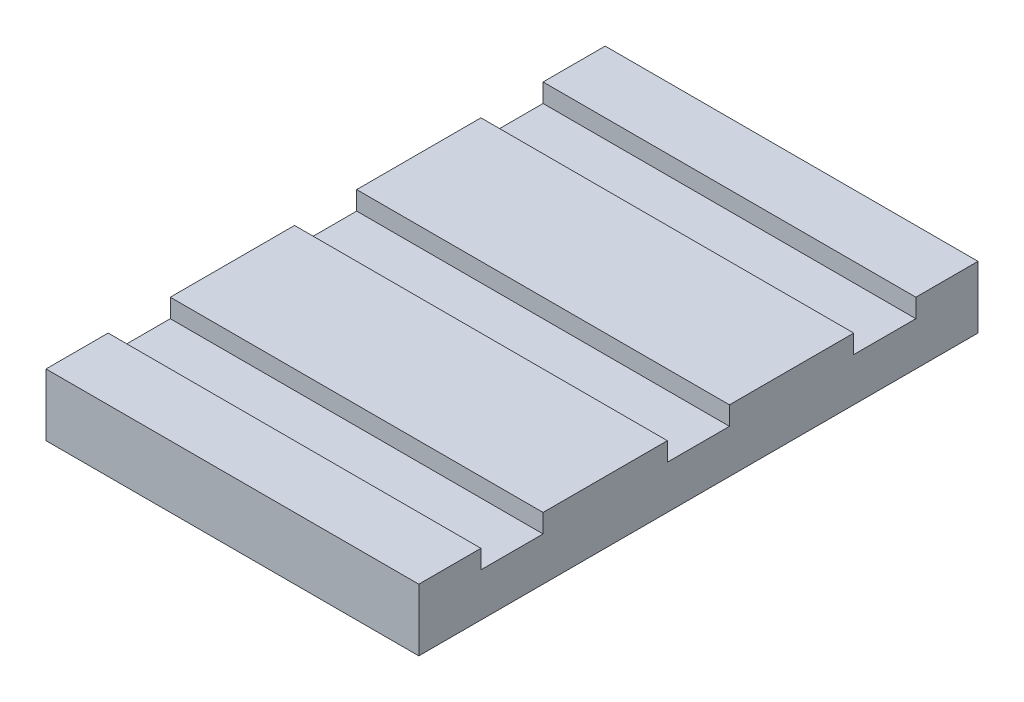
from build123d import *

# Parameters (mm, degrees)
SKETCH2_W           = 76.2
SKETCH2_H           = 114.3
BOSS_EXTRUDE1_DEPTH = 12.7
SKETCH4_W           = 12.7
SKETCH4_H           = 3.81
CUT_EXTRUDE1_DEPTH  = 76.2
SKETCH5_W           = 12.7
SKETCH5_H           = 3.81
CUT_EXTRUDE2_DEPTH  = 76.2


with BuildPart() as part:
    # Sketch2 → Boss-Extrude1 (new body)
    with BuildSketch(Plane(origin=(0, 0, 0), x_dir=(1, 0, 0), z_dir=(0, 1, 0))):
        Rectangle(SKETCH2_W, SKETCH2_H)
    extrude(amount=BOSS_EXTRUDE1_DEPTH)

    # Sketch4 → Cut-Extrude1 (cut)
    with BuildSketch(Plane(origin=(38.1, 0, 0), x_dir=(0, 0, -1), z_dir=(1, 0, 0))):
        with Locations((-38.1, 10.795)):
            Rectangle(SKETCH4_W, SKETCH4_H)
    cut_extrude1 = extrude(amount=-CUT_EXTRUDE1_DEPTH, mode=Mode.SUBTRACT)

    # Mirror1: Cut-Extrude1 across plane
    add(cut_extrude1.mirror(Plane.XY), mode=Mode.SUBTRACT)

    # Sketch5 → Cut-Extrude2 (cut)
    with BuildSketch(Plane(origin=(38.1, 0, 0), x_dir=(0, 0, -1), z_dir=(1, 0, 0))):
        with Locations((0, 10.795)):
            Rectangle(SKETCH5_W, SKETCH5_H)
    extrude(amount=-CUT_EXTRUDE2_DEPTH, mode=Mode.SUBTRACT)


solid = part.part
